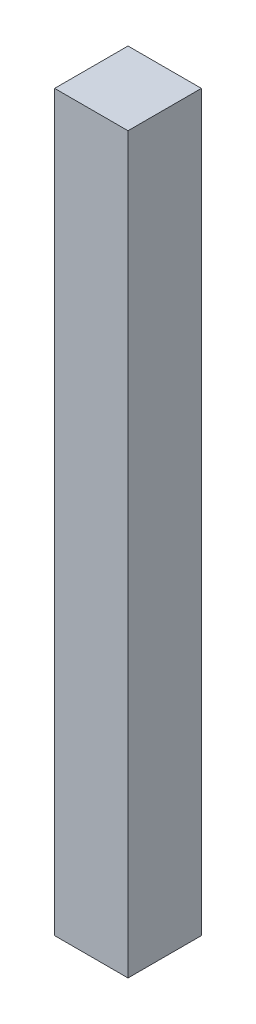
from build123d import *

# Parameters (mm, degrees)
SKETCH1_W           = 20
SKETCH1_H           = 200
BOSS_EXTRUDE1_DEPTH = 20


with BuildPart() as part:
    # Sketch1 → Boss-Extrude1 (new body)
    with BuildSketch(Plane.XY):
        with Locations((10, 100)):
            Rectangle(SKETCH1_W, SKETCH1_H)
    extrude(amount=BOSS_EXTRUDE1_DEPTH)


solid = part.part
